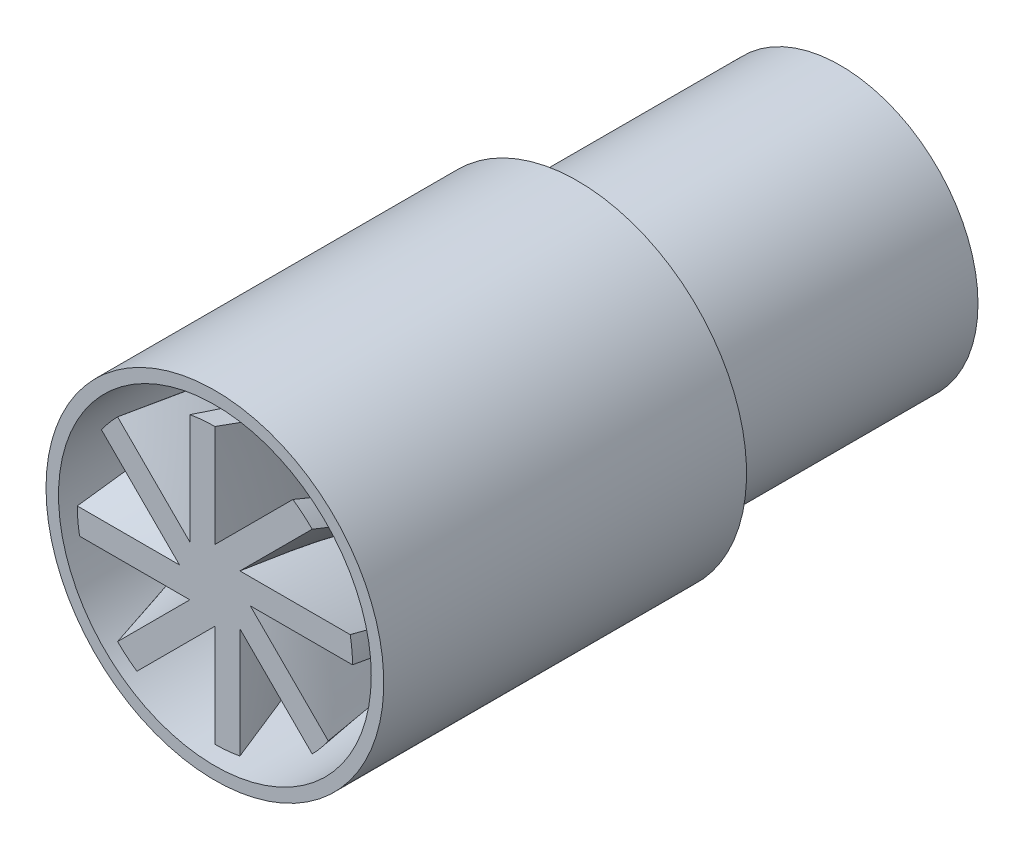
from build123d import *

# Parameters (mm, degrees)
SKETCH1_R           = 13.5
BOSS_EXTRUDE1_DEPTH = 29
SKETCH2_R           = 11
BOSS_EXTRUDE2_DEPTH = 21
SKETCH3_R           = 12.5
SKETCH3_R_2         = 2.5
CUT_EXTRUDE1_DEPTH  = 29
CIRPATTERN1_COUNT   = 8


with BuildPart() as part:
    # Sketch1 → Boss-Extrude1 (new body)
    with BuildSketch(Plane.XY):
        with Locations(Location((0, 0, 0), (0, 0, 180))):
            Circle(SKETCH1_R)
    extrude(amount=BOSS_EXTRUDE1_DEPTH)

    # Sketch2 → Boss-Extrude2 (add)
    with BuildSketch(Plane(origin=(0, 0, 0), x_dir=(-1, 0, 0), z_dir=(0, 0, -1))):
        with Locations(Location((0, 0, 0), (0, 0, 180))):
            Circle(SKETCH2_R)
    extrude(amount=BOSS_EXTRUDE2_DEPTH)

    # Sketch3 → Cut-Extrude1 (cut)
    with BuildSketch(Plane.XY.offset(29)):
        Circle(SKETCH3_R)
        Circle(SKETCH3_R_2, mode=Mode.SUBTRACT)
    extrude(amount=-CUT_EXTRUDE1_DEPTH, mode=Mode.SUBTRACT)


with BuildPart() as cut_extrude1_piece_1:
    # of the separate pieces the step leaves, piece 1, a body of its own (cut_extrude1_pieces)
    add(part.part.solids().sort_by_distance((11, 0, 0))[0])

    # Sketch5 → Loft1 section 0
    with BuildSketch(Plane.XY):
        with BuildLine():
            Line((11, 0), (0, 0))
            Line((0, 0), (0, -2))
            Line((0, -2), (10.816653826, -2))
            ThreePointArc((10.816653826, -2), (10.954067557, -1.004193186), (11, 0))
        make_face()
    # Sketch6 → Loft1 section 1
    with BuildSketch(Plane.XY.offset(29)):
        with BuildLine():
            Line((0, 0), (7.778174593, 7.778174593))
            ThreePointArc((7.778174593, 7.778174593), (7.03562364, 8.455767263), (6.234315708, 9.062742833))
            Line((6.234315708, 9.062742833), (-1.414213562, 1.414213562))
            Line((-1.414213562, 1.414213562), (0, 0))
        make_face()
    loft1 = loft()

    # CirPattern1: Loft1 ×8 about axis
    cirpattern1_axis = Axis((0, 0, 0), (0, 0, 1))
    for i in range(1, CIRPATTERN1_COUNT):
        add(loft1.rotate(cirpattern1_axis, i * 360 / CIRPATTERN1_COUNT))


with BuildPart() as cut_extrude1_piece_2:
    # of the separate pieces the step leaves, piece 2, a body of its own (cut_extrude1_pieces)
    add(part.part.solids().sort_by_distance((-13.5, 0, 0))[0])


solid = Compound([cut_extrude1_piece_1.part, cut_extrude1_piece_2.part])
